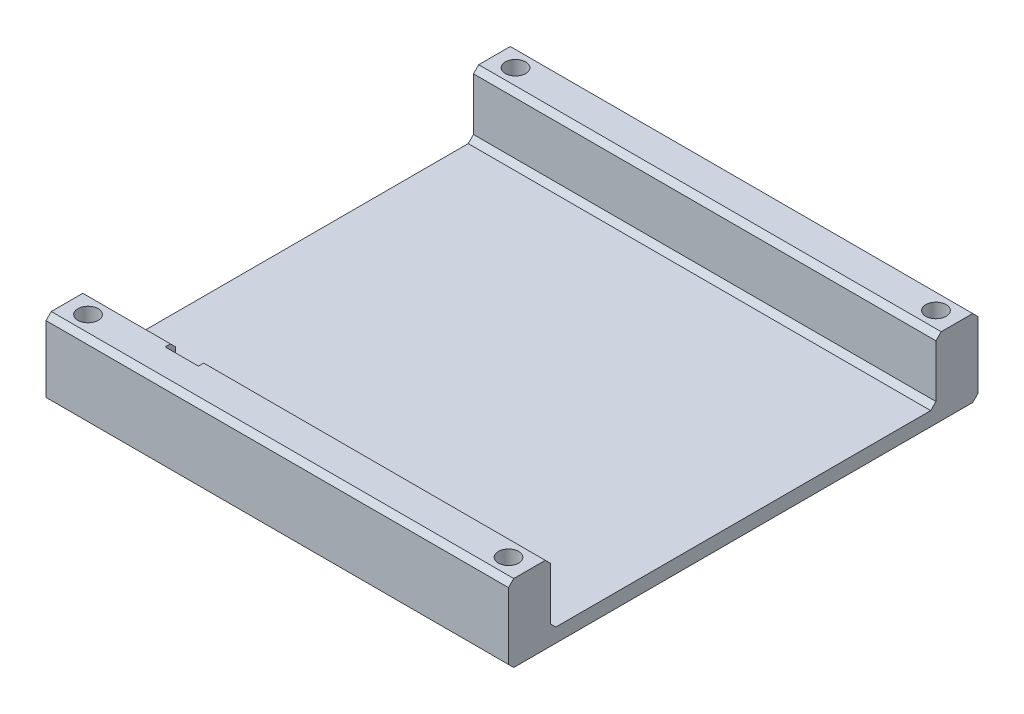
from build123d import *

# Parameters (mm, degrees)
SKETCH1_W           = 66
SKETCH1_H           = 67
BOSS_EXTRUDE1_DEPTH = 2
SKETCH2_W           = 66
SKETCH2_H           = 6
BOSS_EXTRUDE2_DEPTH = 9
SKETCH4_R           = 1.45
CUT_EXTRUDE1_DEPTH  = 3
SKETCH5_R           = 1.05
CUT_EXTRUDE2_DEPTH  = 3
CHAMFER1_SIZE       = 0.75


with BuildPart() as part:
    # Sketch1 → Boss-Extrude1 (new body)
    with BuildSketch(Plane(origin=(0, 0, 0), x_dir=(1, 0, 0), z_dir=(0, 1, 0))):
        with Locations((33, 33.5)):
            Rectangle(SKETCH1_W, SKETCH1_H)
    extrude(amount=BOSS_EXTRUDE1_DEPTH)

    # Sketch2 → Boss-Extrude2 (add)
    with BuildSketch(Plane(origin=(0, 2, 0), x_dir=(1, 0, 0), z_dir=(0, 1, 0))):
        with Locations((33, 64)):
            Rectangle(SKETCH2_W, SKETCH2_H)
        Polygon((17.257397729, 6), (66, 6), (66, 0), (0, 0), (0, 6), (12.5, 6), (12.5, 4.5), (17.257397729, 4.5), align=None)
    extrude(amount=BOSS_EXTRUDE2_DEPTH)

    # Sketch4 → Cut-Extrude1 (cut)
    with BuildSketch(Plane(origin=(0, 11, 0), x_dir=(1, 0, 0), z_dir=(0, 1, 0))):
        with Locations(Location((3, 64, 0), (0, 0, 270))):
            Circle(SKETCH4_R)
        with Locations(Location((63, 64, 0), (0, 0, 270))):
            Circle(SKETCH4_R)
        with Locations(Location((63, 3, 0), (0, 0, 270))):
            Circle(SKETCH4_R)
        with Locations(Location((3, 3, 0), (0, 0, 270))):
            Circle(SKETCH4_R)
    extrude(amount=-CUT_EXTRUDE1_DEPTH, mode=Mode.SUBTRACT)

    # Sketch5 → Cut-Extrude2 (cut)
    with BuildSketch(Plane(origin=(0, 8, 0), x_dir=(1, 0, 0), z_dir=(0, 1, 0))):
        with Locations(Location((3, 64, 0), (0, 0, 270))):
            Circle(SKETCH5_R)
        with Locations(Location((63, 64, 0), (0, 0, 270))):
            Circle(SKETCH5_R)
        with Locations(Location((63, 3, 0), (0, 0, 270))):
            Circle(SKETCH5_R)
        with Locations(Location((3, 3, 0), (0, 0, 270))):
            Circle(SKETCH5_R)
    extrude(amount=-CUT_EXTRUDE2_DEPTH, mode=Mode.SUBTRACT)

    # Chamfer1
    chamfer1_edges = [part.edges().sort_by_distance(p)[0] for p in [
        (33, 2, -61),
        (33, 11, -61),
        (33, 11, -67),
        (41.628698864, 2, -6),
        (6.25, 2, -6),
        (33, 11, 0),
        (41.628698864, 11, -6),
        (6.25, 11, -6),
        (33, 0, -67),
        (33, 0, 0),
    ]]
    chamfer(chamfer1_edges, length=CHAMFER1_SIZE)


solid = part.part
